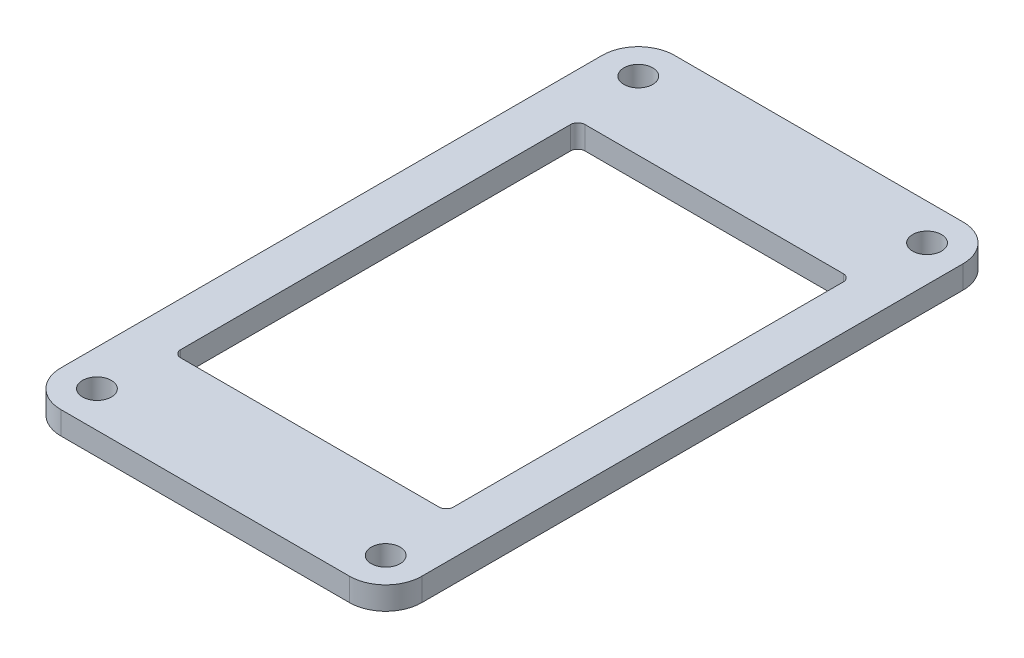
from build123d import *

# Parameters (mm, degrees)
SKETCH1_W           = 50
SKETCH1_H           = 85
BOSS_EXTRUDE1_DEPTH = 3.175
SKETCH3_W           = 37.782
SKETCH3_H           = 56.004
CUT_EXTRUDE1_DEPTH  = 99.666512176
FILLET2_R           = 1
FILLET3_R           = 5
SKETCH4_R           = 2
CUT_EXTRUDE2_DEPTH  = 99.666512176


with BuildPart() as part:
    # Sketch1 → Boss-Extrude1 (new body)
    with BuildSketch(Plane(origin=(0, 0, 0), x_dir=(1, 0, 0), z_dir=(0, 1, 0))):
        with Locations((25, 42.5)):
            Rectangle(SKETCH1_W, SKETCH1_H)
    extrude(amount=BOSS_EXTRUDE1_DEPTH)

    # Sketch3 → Cut-Extrude1 (cut, through all)
    with BuildSketch(Plane(origin=(0, 3.175, 0), x_dir=(1, 0, 0), z_dir=(0, 1, 0))):
        with Locations((25, 42.5)):
            Rectangle(SKETCH3_W, SKETCH3_H)
    extrude(amount=-CUT_EXTRUDE1_DEPTH, mode=Mode.SUBTRACT)

    # Fillet2
    fillet2_edges = [part.edges().sort_by_distance(p)[0] for p in [
        (6.109, 1.5875, -14.498),
        (6.109, 1.5875, -70.502),
        (43.891, 1.5875, -70.502),
        (43.891, 1.5875, -14.498),
    ]]
    fillet(fillet2_edges, radius=FILLET2_R)

    # Fillet3
    fillet3_edges = [part.edges().sort_by_distance(p)[0] for p in [
        (0, 1.5875, -85),
        (50, 1.5875, -85),
        (50, 1.5875, 0),
        (0, 1.5875, 0),
    ]]
    fillet(fillet3_edges, radius=FILLET3_R)

    # Sketch4 → Cut-Extrude2 (cut, through all)
    with BuildSketch(Plane(origin=(0, 3.175, 0), x_dir=(1, 0, 0), z_dir=(0, 1, 0))):
        with Locations(Location((5, 5, 0), (0, 0, 270))):
            Circle(SKETCH4_R)
        with Locations(Location((45, 5, 0), (0, 0, 270))):
            Circle(SKETCH4_R)
        with Locations(Location((45, 80, 0), (0, 0, 270))):
            Circle(SKETCH4_R)
        with Locations(Location((5, 80, 0), (0, 0, 270))):
            Circle(SKETCH4_R)
    extrude(amount=-CUT_EXTRUDE2_DEPTH, mode=Mode.SUBTRACT)


solid = part.part
